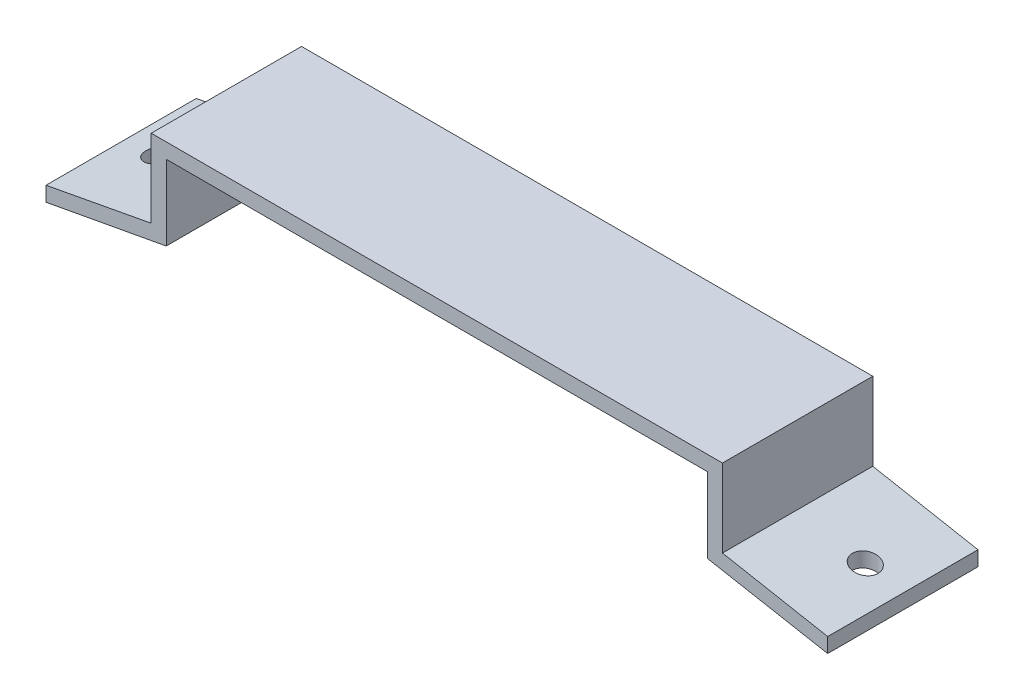
from build123d import *

# Parameters (mm, degrees)
BOSS_EXTRU_5_DEPTH      = 10
ESQUISSE1_W             = 38
ESQUISSE1_H             = 20
BOSS_EXTRU_6_DEPTH      = 12
ESQUISSE1_9_W           = 36
ESQUISSE1_9_H           = 20
ENL_V_MAT_EXTRU_4_DEPTH = 10
ESQUISSE1_10_R          = 1.7
ENL_V_MAT_EXTRU_5_DEPTH = 55.295487842


with BuildPart() as part:
    # Esquisse3 → Boss.-Extru.5 (new, symmetric)
    with BuildSketch(Plane.XY):
        Polygon((-36, 0), (-52, -2.958401047), (-52, -0.992722896), (-36, 2), align=None)
    boss_extru_5 = extrude(amount=BOSS_EXTRU_5_DEPTH, both=True)

    # Esquisse1 → Boss.-Extru.6 (add)
    with BuildSketch(Plane(origin=(0, 0, 0), x_dir=(1, 0, 0), z_dir=(0, 1, 0))):
        with Locations((-19, 0)):
            Rectangle(ESQUISSE1_W, ESQUISSE1_H)
    boss_extru_6 = extrude(amount=BOSS_EXTRU_6_DEPTH)

    # Esquisse1<9> → Enlèv. mat.-Extru.4 (cut)
    with BuildSketch(Plane(origin=(0, 0, 0), x_dir=(1, 0, 0), z_dir=(0, 1, 0))):
        with Locations((-18, 0)):
            Rectangle(ESQUISSE1_9_W, ESQUISSE1_9_H)
    enl_v_mat_extru_4 = extrude(amount=ENL_V_MAT_EXTRU_4_DEPTH, mode=Mode.SUBTRACT)

    # Esquisse1<10> → Enlèv. mat.-Extru.5 (cut, symmetric)
    with BuildSketch(Plane(origin=(0, 0, 0), x_dir=(1, 0, 0), z_dir=(0, 1, 0))):
        with Locations((-47, 0)):
            Circle(ESQUISSE1_10_R)
    enl_v_mat_extru_5 = extrude(amount=ENL_V_MAT_EXTRU_5_DEPTH, both=True, mode=Mode.SUBTRACT)

    # Symétrie4: Boss.-Extru.5, Boss.-Extru.6, Enlèv. mat.-Extru.4, Enlèv. mat.-Extru.5 across plane
    add(boss_extru_5.mirror(Plane(origin=(0, 0, 0), x_dir=(0, 0, 1), z_dir=(1, 0, 0))))
    add(boss_extru_6.mirror(Plane(origin=(0, 0, 0), x_dir=(0, 0, 1), z_dir=(1, 0, 0))))
    add(enl_v_mat_extru_4.mirror(Plane(origin=(0, 0, 0), x_dir=(0, 0, 1), z_dir=(1, 0, 0))), mode=Mode.SUBTRACT)
    add(enl_v_mat_extru_5.mirror(Plane(origin=(0, 0, 0), x_dir=(0, 0, 1), z_dir=(1, 0, 0))), mode=Mode.SUBTRACT)


solid = part.part
